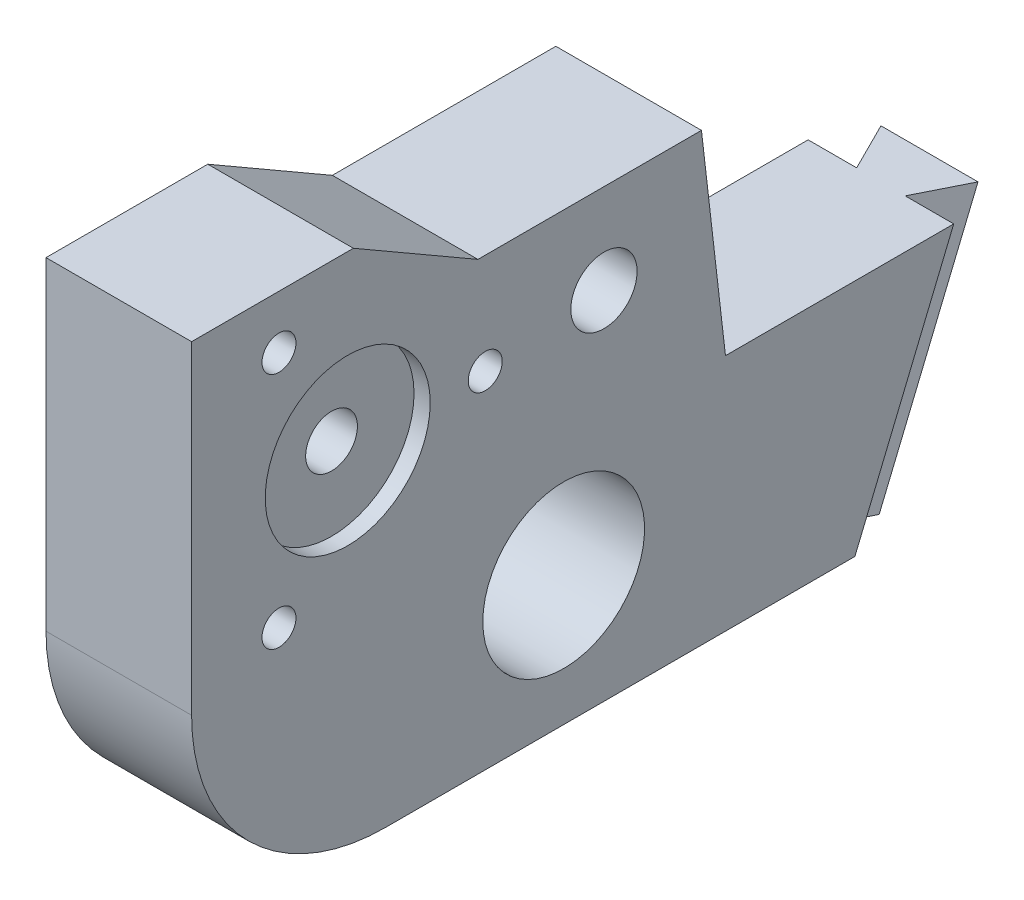
from build123d import *

# Parameters (mm, degrees)
SKETCH1_W                                        = 32
SKETCH1_H                                        = 52
BOSS_EXTRUDE1_DEPTH                              = 9
CUT_EXTRUDE2_DEPTH                               = 58.078892771
F_10_0_10_DIAMETER_HOLE1_D                       = 10
FILLET3_R                                        = 12
CUT_EXTRUDE3_DEPTH                               = 58.078892771
CUT_EXTRUDE3_DEPTH_BACK                          = 58.078892771
M4X0_7_TAPPED_HOLE2_D                            = 2.1
M4X0_7_TAPPED_HOLE2_CBORE_D                      = 3.3
M4X0_7_TAPPED_HOLE2_CBORE_DEPTH                  = 2
CBORE_FOR_M3_HEX_HEAD_MACHINE_SCREW5_D           = 3.2
CBORE_FOR_M3_HEX_HEAD_MACHINE_SCREW5_CBORE_D     = 10.2
CBORE_FOR_M3_HEX_HEAD_MACHINE_SCREW5_CBORE_DEPTH = 1
F_4_1_4_1_DIAMETER_HOLE3_D                       = 4.1
CUT_EXTRUDE4_DEPTH                               = 58.078892771
CUT_EXTRUDE4_DEPTH_BACK                          = 58.078892771


with BuildPart() as part:
    # Sketch1 → Boss-Extrude1 (new body)
    with BuildSketch(Plane(origin=(-2, 0, 0), x_dir=(0, -1, 0), z_dir=(-1, 0, 0))):
        with Locations((-8, 25)):
            Rectangle(SKETCH1_W, SKETCH1_H)
    extrude(amount=-BOSS_EXTRUDE1_DEPTH)

    # Sketch3 → Cut-Extrude2 (cut, through all)
    with BuildSketch(Plane(origin=(7, 0, 0), x_dir=(0, 0, -1), z_dir=(1, 0, 0))):
        Polygon((4, 6.75), (-18, 6.75), (-20, 24), (4, 24), align=None)
    extrude(amount=-CUT_EXTRUDE2_DEPTH, mode=Mode.SUBTRACT)

    # Ø10.0 (10) Diameter Hole1 (through all)
    with Locations(Plane.ZY.offset(2)):
        with Locations((28, 0)):
            Hole(F_10_0_10_DIAMETER_HOLE1_D / 2)

    # Fillet3
    fillet3_edges = [part.edges().sort_by_distance(p)[0] for p in [
        (2.5, -8, 51),
    ]]
    fillet(fillet3_edges, radius=FILLET3_R)

    # Cut-Sweep1: sweep along a path in Sketch22
    with BuildLine(Plane(origin=(-2, 0, 0), x_dir=(0, -1, 0), z_dir=(-1, 0, 0))) as cut_sweep1_path:
        Line((8, 11), (-6.75, 4.890349955))
    # Sketch21 → Cut-Sweep1 (sweep, cut)
    with BuildSketch(Plane.XZ.offset(8)):
        Polygon((7, 7), (5.5, 7), (4, 10), (7, 10), align=None)
        Polygon((1, 10), (-0.5, 7), (-2, 7), (-2, 10), align=None)
    sweep(path=cut_sweep1_path.line, mode=Mode.SUBTRACT)

    # Sketch23 → Cut-Extrude3 (cut, two sides: drawn at the far end of the back side and taken through both)
    with BuildSketch(Plane.ZY.offset(2).offset(-CUT_EXTRUDE3_DEPTH_BACK)):
        Polygon((-1, 6.75), (-1, -8), (7, -8), (0.890349955, 6.75), align=None)
    extrude(amount=CUT_EXTRUDE3_DEPTH + CUT_EXTRUDE3_DEPTH_BACK, mode=Mode.SUBTRACT)

    # M4x0.7 Tapped Hole2 (through all)
    with Locations(Plane(origin=(-2, 13.349760492, 32.849760492), x_dir=(0, 0, -1), z_dir=(-1, 0, 0))):
        with Locations((0, 0), (-12.75, -7.361215932), (-12.75, 7.361215932)):
            CounterBoreHole(M4X0_7_TAPPED_HOLE2_D / 2, M4X0_7_TAPPED_HOLE2_CBORE_D / 2, M4X0_7_TAPPED_HOLE2_CBORE_DEPTH)

    # CBORE for M3 Hex Head Machine Screw5 (through all)
    with Locations(Plane(origin=(7, 13.349760492, 41.349760492), x_dir=(0, 0, 1), z_dir=(1, 0, 0))):
        with Locations((0, 0)):
            CounterBoreHole(CBORE_FOR_M3_HEX_HEAD_MACHINE_SCREW5_D / 2, CBORE_FOR_M3_HEX_HEAD_MACHINE_SCREW5_CBORE_D / 2, CBORE_FOR_M3_HEX_HEAD_MACHINE_SCREW5_CBORE_DEPTH)

    # Ø4.1 (4.1) Diameter Hole3 (through all)
    with Locations(Plane(origin=(-2, 14, 25.510762466), x_dir=(0, 0, -1), z_dir=(-1, 0, 0))):
        with Locations((0, 0)):
            Hole(F_4_1_4_1_DIAMETER_HOLE3_D / 2)

    # Sketch37 → Cut-Extrude4 (cut, two sides: drawn at the far end of the back side and taken through both)
    with BuildSketch(Plane.ZY.offset(2).offset(-CUT_EXTRUDE4_DEPTH_BACK)):
        Polygon((33.300431818, 19.554652238), (41, 24), (20, 24), (19.874101839, 22.914128361), (19.484597361, 19.554652238), align=None)
    extrude(amount=CUT_EXTRUDE4_DEPTH + CUT_EXTRUDE4_DEPTH_BACK, mode=Mode.SUBTRACT)


solid = part.part
